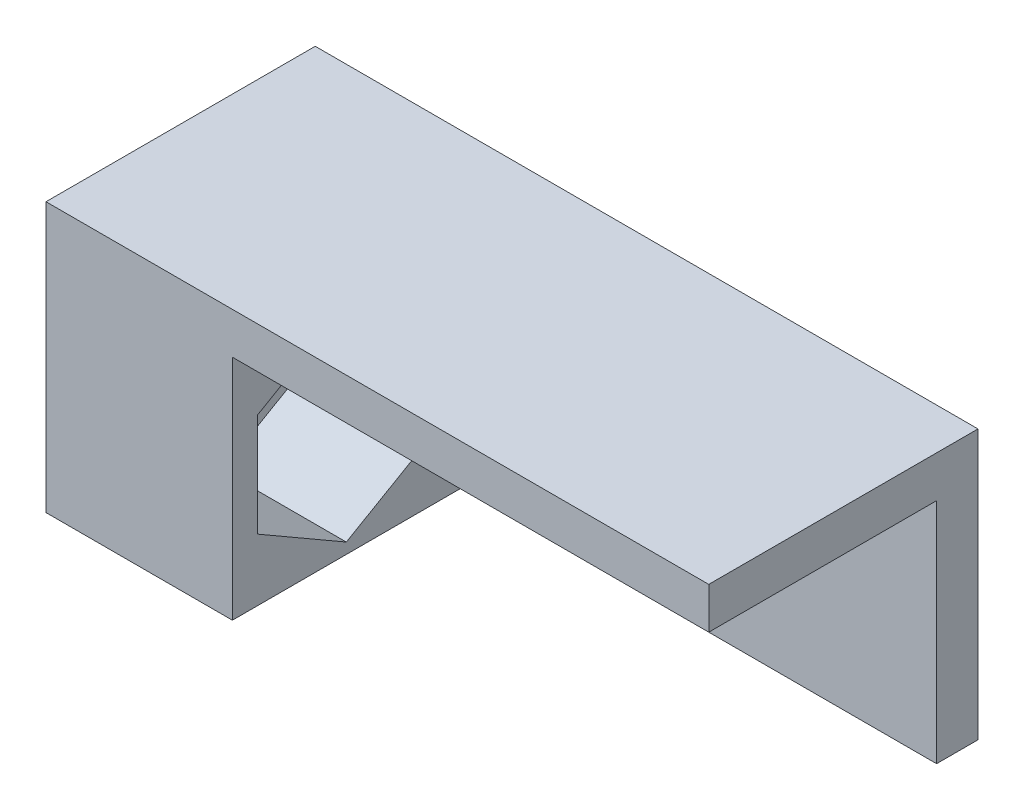
from build123d import *

# Parameters (mm, degrees)
SKETCH_1_W          = 32
SKETCH_1_H          = 13
EXTRUDE_1_DEPTH     = 2
SKETCH_2_W          = 32
SKETCH_2_H          = 2
EXTRUDE_2_DEPTH     = 11
SKETCH_3_W          = 9
SKETCH_3_H          = 11
EXTRUDE_3_DEPTH     = 11
CUT_EXTRUDE_1_DEPTH = 6
SKETCH_5_R          = 2.1
CUT_EXTRUDE_2_DEPTH = 3


with BuildPart() as part:
    # 草图1 → 凸台-拉伸1 (new body)
    with BuildSketch(Plane(origin=(0, 0, 0), x_dir=(1, 0, 0), z_dir=(0, 1, 0))):
        with Locations((2.487093154, 5.054433221)):
            Rectangle(SKETCH_1_W, SKETCH_1_H)
    extrude(amount=EXTRUDE_1_DEPTH)

    # 草图2 → 凸台-拉伸2 (add)
    with BuildSketch(Plane(origin=(0, 0, 0), x_dir=(-1, 0, 0), z_dir=(0, -1, 0))):
        with Locations((-2.487093154, 10.554433221)):
            Rectangle(SKETCH_2_W, SKETCH_2_H)
    extrude(amount=EXTRUDE_2_DEPTH)

    # 草图3 → 凸台-拉伸3 (add)
    with BuildSketch(Plane.XZ):
        with Locations((-9.012906846, -4.054433221)):
            Rectangle(SKETCH_3_W, SKETCH_3_H)
    extrude(amount=EXTRUDE_3_DEPTH)

    # 草图4 → 切除-拉伸1 (cut)
    with BuildSketch(Plane(origin=(-4.512906846, 0, 0), x_dir=(0, 0, -1), z_dir=(1, 0, 0))):
        Polygon((4.054433221, -10.48042463), (8.354433221, -7.997818473), (8.354433221, -3.032606158), (4.054433221, -0.55), (-0.245566779, -3.032606158), (-0.245566779, -7.997818473), align=None)
    extrude(amount=-CUT_EXTRUDE_1_DEPTH, mode=Mode.SUBTRACT)

    # 草图5 → 切除-拉伸2 (cut)
    with BuildSketch(Plane(origin=(-10.512906846, 0, 0), x_dir=(0, 0, -1), z_dir=(1, 0, 0))):
        with Locations((4.054433221, -5.515212315)):
            Circle(SKETCH_5_R)
    extrude(amount=-CUT_EXTRUDE_2_DEPTH, mode=Mode.SUBTRACT)


solid = part.part
